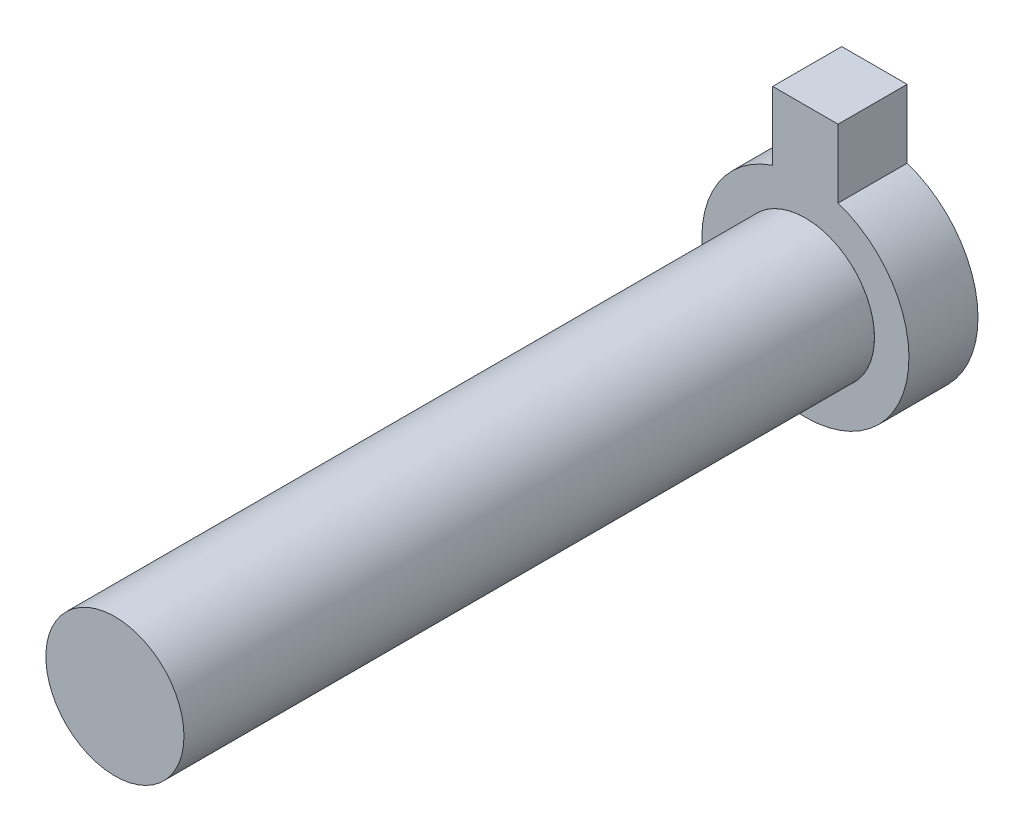
from build123d import *

# Parameters (mm, degrees)
CUT_EXTRUDE2_START  = -50
SKETCH4_R           = 50
CUT_EXTRUDE2_DEPTH  = 50
BOSS_EXTRUDE2_DEPTH = 50


with BuildPart() as part:
    # Sketch2 → Revolve1 (revolve)
    with BuildSketch(Plane(origin=(0, 0, 0), x_dir=(0, 0, -1), z_dir=(1, 0, 0)), mode=Mode.PRIVATE) as revolve1_sk:
        Polygon((0, 0), (550, 0), (550, -75), (500, -75), (500, -50), (0, -50), align=None)
    revolve(revolve1_sk.sketch.rotate(Axis((0, 0, 0), (0, 0, -1)), 270), axis=Axis((0, 0, 0), (0, 0, -1)))

    # Sketch4 → Cut-Extrude2 (cut)
    with BuildSketch(Plane(origin=(0, 0, -550), x_dir=(-1, 0, 0), z_dir=(0, 0, -1)).offset(CUT_EXTRUDE2_START)):
        Circle(SKETCH4_R)
    extrude(amount=CUT_EXTRUDE2_DEPTH, mode=Mode.SUBTRACT)


with BuildPart() as cut_extrude2_piece_1:
    # of the separate pieces the step leaves, piece 1, a body of its own (cut_extrude2_pieces)
    add(part.part.solids().sort_by_distance((50, 0, 0))[0])


with BuildPart() as cut_extrude2_piece_2:
    # of the separate pieces the step leaves, piece 2, a body of its own (cut_extrude2_pieces)
    add(part.part.solids().sort_by_distance((75, 0, -550))[0])

    # Sketch5 → Boss-Extrude2 (add)
    with BuildSketch(Plane(origin=(0, 0, -550), x_dir=(-1, 0, 0), z_dir=(0, 0, -1))):
        with BuildLine():
            Line((-23.685914499, 120.661191056), (23.685914499, 120.661191056))
            Line((23.685914499, 120.661191056), (23.685914499, 71.161629087))
            ThreePointArc((23.685914499, 71.161629087), (0, 75), (-23.685914499, 71.161629087))
            Line((-23.685914499, 71.161629087), (-23.685914499, 120.661191056))
        make_face()
    extrude(amount=-BOSS_EXTRUDE2_DEPTH)


solid = Compound([cut_extrude2_piece_1.part, cut_extrude2_piece_2.part])
